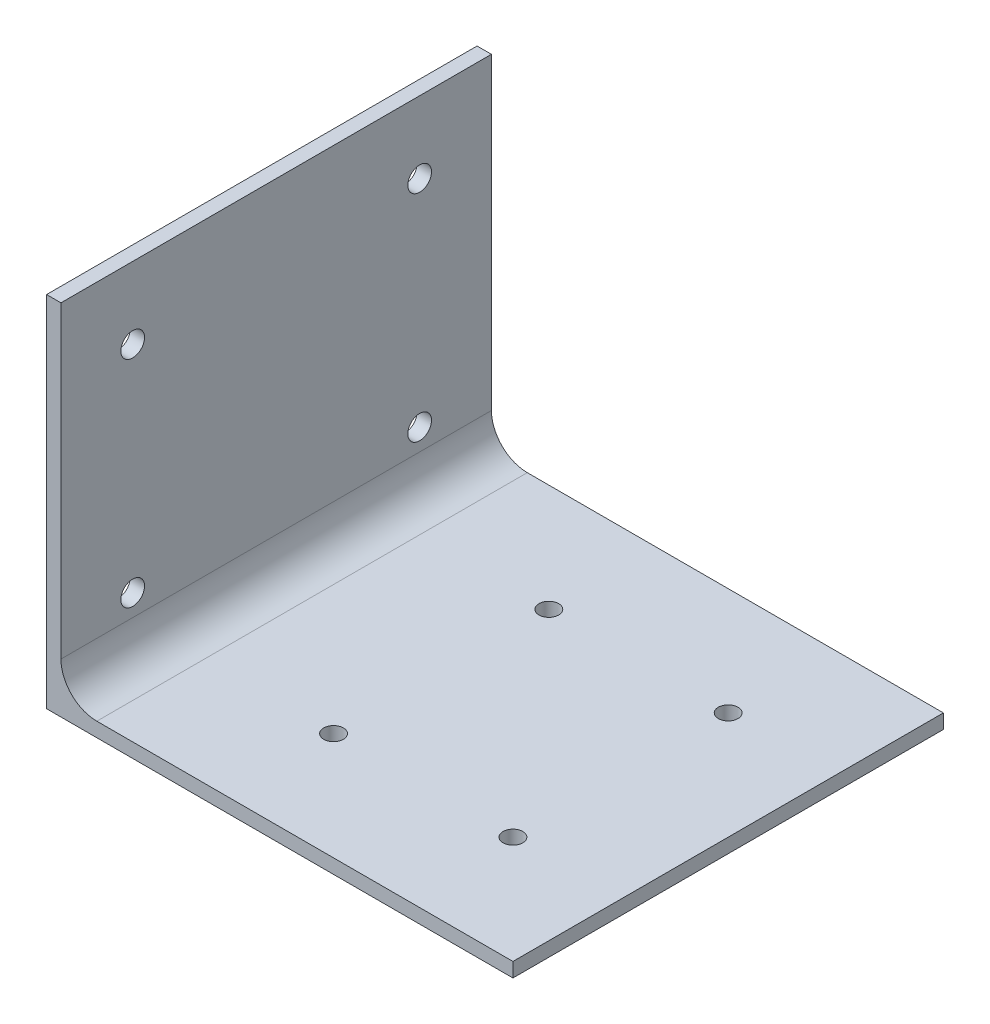
from build123d import *

# Parameters (mm, degrees)
BOSS_EXTRUDE1_DEPTH = 120
SKETCH4_R           = 3.3
CUT_EXTRUDE1_DEPTH  = 201.688813839
SKETCH5_R           = 2.75
CUT_EXTRUDE2_DEPTH  = 202.285866369
FILLET1_R           = 10


with BuildPart() as part:
    # Sketch2 → Boss-Extrude1 (new body)
    with BuildSketch(Plane.XY):
        Polygon((0, 0), (0, 100), (4, 100), (4, 4), (130, 4), (130, 0), align=None)
    extrude(amount=BOSS_EXTRUDE1_DEPTH)

    # Sketch4 → Cut-Extrude1 (cut, through all)
    with BuildSketch(Plane(origin=(4, 0, 0), x_dir=(0, 0, -1), z_dir=(1, 0, 0))):
        with Locations(Location((-100, 80, 0), (0, 0, 90))):
            Circle(SKETCH4_R)
        with Locations(Location((-20, 80, 0), (0, 0, 90))):
            Circle(SKETCH4_R)
        with Locations(Location((-20, 20, 0), (0, 0, 90))):
            Circle(SKETCH4_R)
        with Locations(Location((-100, 20, 0), (0, 0, 90))):
            Circle(SKETCH4_R)
    extrude(amount=-CUT_EXTRUDE1_DEPTH, mode=Mode.SUBTRACT)

    # Sketch5 → Cut-Extrude2 (cut, through all)
    with BuildSketch(Plane(origin=(0, 4, 0), x_dir=(1, 0, 0), z_dir=(0, 1, 0))):
        with Locations(Location((100, -30, 0), (0, 0, 180))):
            Circle(SKETCH5_R)
        with Locations(Location((50, -30, 0), (0, 0, 180))):
            Circle(SKETCH5_R)
        with Locations(Location((50, -90, 0), (0, 0, 180))):
            Circle(SKETCH5_R)
        with Locations(Location((100, -90, 0), (0, 0, 180))):
            Circle(SKETCH5_R)
    extrude(amount=-CUT_EXTRUDE2_DEPTH, mode=Mode.SUBTRACT)

    # Fillet1
    fillet1_edges = [part.edges().sort_by_distance(p)[0] for p in [
        (4, 4, 60),
    ]]
    fillet(fillet1_edges, radius=FILLET1_R)


solid = part.part
